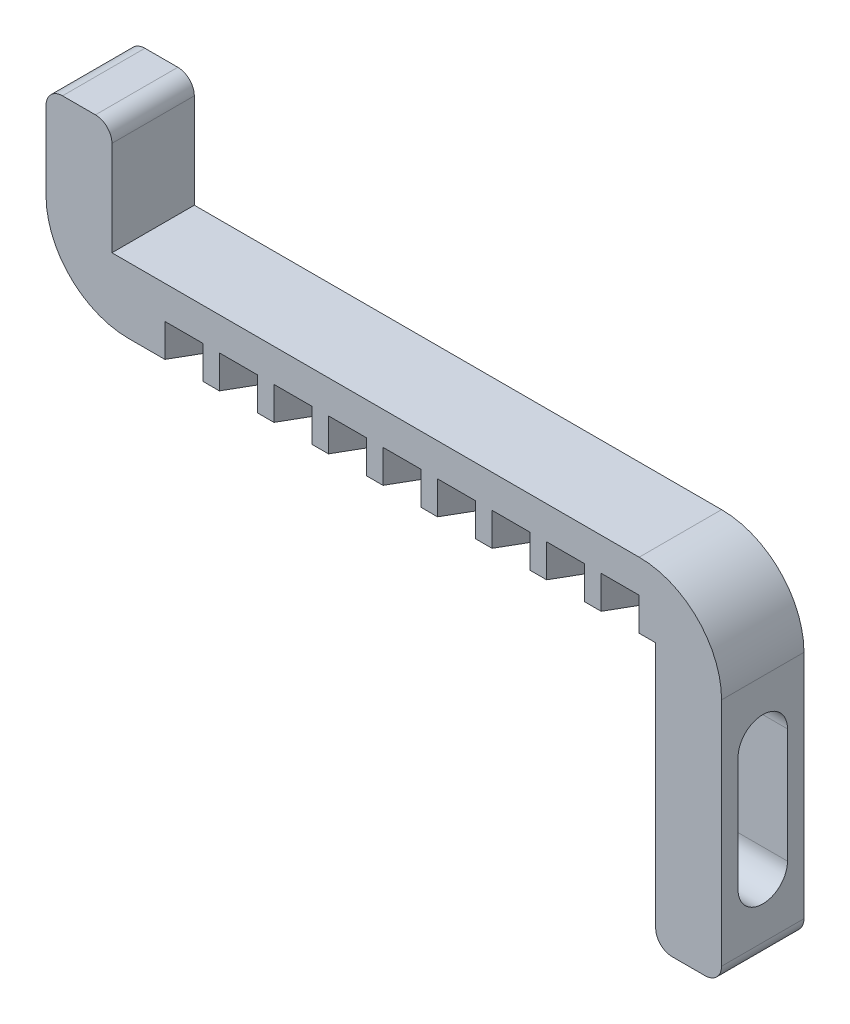
from build123d import *

# Parameters (mm, degrees)
BOSS_EXTRUDE1_DEPTH = 5
CUT_EXTRUDE1_DEPTH  = 41.620192023
FILLET2_R           = 5
FILLET3_R           = 1
CUT_EXTRUDE2_DEPTH  = 2


with BuildPart() as part:
    # Sketch1 → Boss-Extrude1 (new body)
    with BuildSketch(Plane.XY):
        Polygon((0, 0), (33, 0), (33, -16), (37, -16), (37, 4), (0, 4), (0, 10.75), (-4, 10.75), (-4, 0), align=None)
    extrude(amount=BOSS_EXTRUDE1_DEPTH)

    # Sketch3 → Cut-Extrude1 (cut, through all)
    with BuildSketch(Plane.ZY.offset(-33)):
        with BuildLine():
            Line((4, -4.524146601), (4, -11.475853399))
            ThreePointArc((4, -11.475853399), (2.5, -12.975853399), (1, -11.475853399))
            Line((1, -11.475853399), (1, -4.524146601))
            ThreePointArc((1, -4.524146601), (2.5, -3.024146601), (4, -4.524146601))
        make_face()
    extrude(amount=-CUT_EXTRUDE1_DEPTH, mode=Mode.SUBTRACT)

    # Fillet2
    fillet2_edges = [part.edges().sort_by_distance(p)[0] for p in [
        (-4, 0, 2.5),
        (37, 4, 2.5),
    ]]
    fillet(fillet2_edges, radius=FILLET2_R)

    # Fillet3
    fillet3_edges = [part.edges().sort_by_distance(p)[0] for p in [
        (-4, 10.75, 2.5),
        (0, 10.75, 2.5),
        (37, -16, 2.5),
        (33, -16, 2.5),
    ]]
    fillet(fillet3_edges, radius=FILLET3_R)

    # Sketch4 → Cut-Extrude2 (cut)
    with BuildSketch(Plane(origin=(0, 0, 0), x_dir=(-1, 0, 0), z_dir=(0, -1, 0))):
        Polygon((-30.845299462, -3), (-32, -5), (-29.690598923, -5), align=None)
        Polygon((-30.845299462, -2), (-29.690598923, 0), (-32, 0), align=None)
        Polygon((-27.535299462, -3), (-28.69, -5), (-26.380598923, -5), align=None)
        Polygon((-27.535299462, -2), (-26.380598923, 0), (-28.69, 0), align=None)
        Polygon((-24.225299462, -3), (-25.38, -5), (-23.070598923, -5), align=None)
        Polygon((-24.225299462, -2), (-23.070598923, 0), (-25.38, 0), align=None)
        Polygon((-20.915299462, -3), (-22.07, -5), (-19.760598923, -5), align=None)
        Polygon((-20.915299462, -2), (-19.760598923, 0), (-22.07, 0), align=None)
        Polygon((-17.605299462, -3), (-18.76, -5), (-16.450598923, -5), align=None)
        Polygon((-17.605299462, -2), (-16.450598923, 0), (-18.76, 0), align=None)
        Polygon((-14.295299462, -3), (-15.45, -5), (-13.140598923, -5), align=None)
        Polygon((-14.295299462, -2), (-13.140598923, 0), (-15.45, 0), align=None)
        Polygon((-10.985299462, -3), (-12.14, -5), (-9.830598923, -5), align=None)
        Polygon((-10.985299462, -2), (-9.830598923, 0), (-12.14, 0), align=None)
        Polygon((-7.675299462, -3), (-8.83, -5), (-6.520598923, -5), align=None)
        Polygon((-7.675299462, -2), (-6.520598923, 0), (-8.83, 0), align=None)
        Polygon((-4.365299462, -3), (-5.52, -5), (-3.210598923, -5), align=None)
        Polygon((-4.365299462, -2), (-3.210598923, 0), (-5.52, 0), align=None)
    extrude(amount=-CUT_EXTRUDE2_DEPTH, mode=Mode.SUBTRACT)


solid = part.part
